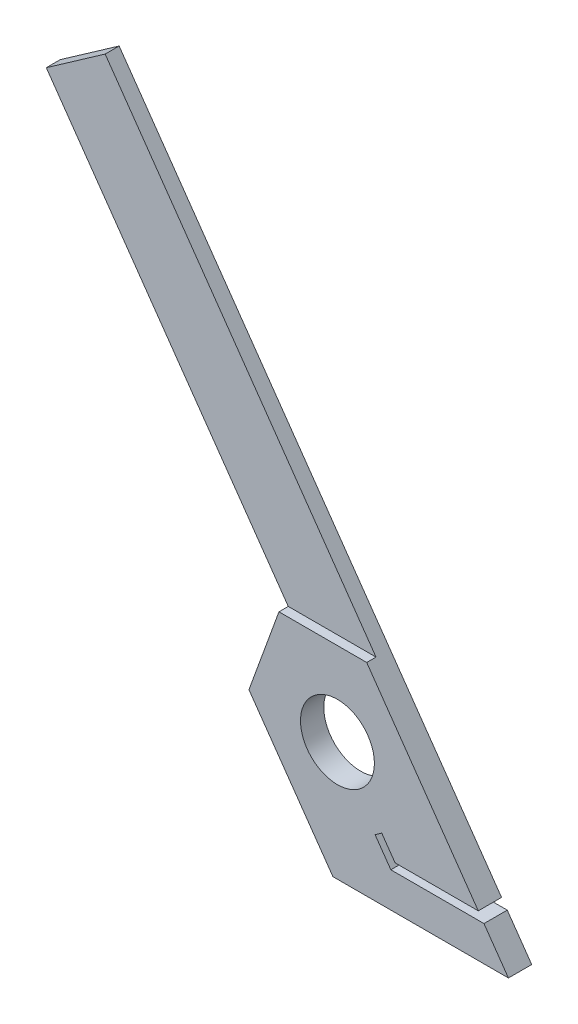
from build123d import *

# Parameters (mm, degrees)
SKETCH1_R           = 3.175
BOSS_EXTRUDE1_DEPTH = 1.2
SKETCH2_R           = 3.175
BOSS_EXTRUDE2_DEPTH = 0.8


with BuildPart() as part:
    # Sketch1 → Boss-Extrude1 (new body)
    with BuildSketch(Plane.XY):
        Polygon((-0.387763394, -10.212000445), (-7.602233748, 0.091331011), (-5.023989087, 7.175), (-25.810939636, 36.861841993), (-20.752675762, 40.403676487), (12.098034886, -6.512000445), (4.952577098, -6.512000445), (3.805424226, -4.873696357), (3.232017795, -5.275199862), (4.588180163, -7.212000445), (12.588180163, -7.212000445), (14.688802778, -10.212000445), align=None)
        Circle(SKETCH1_R, mode=Mode.SUBTRACT)
    extrude(amount=BOSS_EXTRUDE1_DEPTH)

    # Sketch2 → Boss-Extrude2 (add)
    with BuildSketch(Plane.XY.offset(1.2)):
        Polygon((-5.023989087, 7.175), (2.514293999, 7.175), (12.098034886, -6.512000445), (4.952577098, -6.512000445), (3.805424226, -4.873696357), (3.232017795, -5.275199862), (4.588180163, -7.212000445), (12.588180163, -7.212000445), (14.688802778, -10.212000445), (-0.387763394, -10.212000445), (-7.602233748, 0.091331011), align=None)
        Circle(SKETCH2_R, mode=Mode.SUBTRACT)
    extrude(amount=BOSS_EXTRUDE2_DEPTH)


solid = part.part
